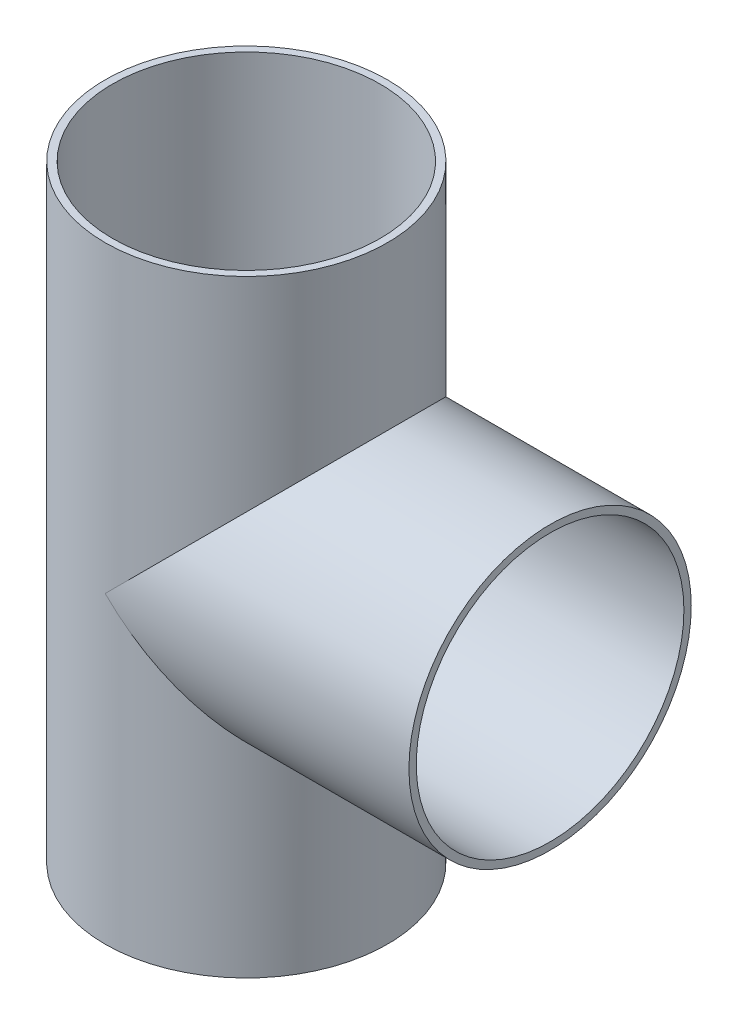
from build123d import *

# Parameters (mm, degrees)
EXTRUDE1_DEPTH          = 68.326
EXTRUDE1_DEPTH_BACK     = 68.326
SKETCH1_R               = 31.75
EXTRUDE2_REACH          = 127.267
EXTRUDE2_END_RADIUS     = 31.75
SKETCH3_R               = 31.75
SKETCH4_R               = 30.099
CUT_EXTRUDE1_DEPTH      = 68.326
CUT_EXTRUDE2_DEPTH      = 102.710112831
CUT_EXTRUDE2_DEPTH_BACK = 102.710112831
SKETCH5_R               = 30.099


with BuildPart() as part:
    # Sketch1 → Extrude1 (new, two sides: drawn at the far end of the back side and taken through both)
    with BuildSketch(Plane(origin=(0, 0, 0), x_dir=(1, 0, 0), z_dir=(0, 1, 0)).offset(-EXTRUDE1_DEPTH_BACK)):
        with Locations(Location((0, 0, 0), (0, 0, 270))):
            Circle(SKETCH1_R)
    extrude(amount=EXTRUDE1_DEPTH + EXTRUDE1_DEPTH_BACK)

    # Extrude2: up to this cylinder (the profile starts outside it)
    extrude2_end = Plane(origin=(0, 0, 0), z_dir=(0, 1, 0)) * Cylinder(EXTRUDE2_END_RADIUS, 319.034, mode=Mode.PRIVATE)
    # Sketch3 → Extrude2 (add, up to the surface)
    with BuildSketch(Plane(origin=(68.326, 0, 0), x_dir=(0, 0, -1), z_dir=(1, 0, 0)), mode=Mode.PRIVATE) as extrude2_sk1:
        Circle(SKETCH3_R)
    extrude2_tool1 = extrude(extrude2_sk1.sketch, amount=-EXTRUDE2_REACH, mode=Mode.PRIVATE) - extrude2_end
    add(extrude2_tool1.solids().sort_by_distance((68.326, 0, 0))[0])

    # Sketch4 → Cut-Extrude1 (cut)
    with BuildSketch(Plane(origin=(68.326, 0, 0), x_dir=(0, 0, -1), z_dir=(1, 0, 0))):
        Circle(SKETCH4_R)
    extrude(amount=-CUT_EXTRUDE1_DEPTH, mode=Mode.SUBTRACT)

    # Sketch5 → Cut-Extrude2 (cut, two sides: drawn at the far end of the back side and taken through both)
    with BuildSketch(Plane(origin=(0, 0, 0), x_dir=(1, 0, 0), z_dir=(0, 1, 0)).offset(-CUT_EXTRUDE2_DEPTH_BACK)):
        with Locations(Location((0, 0, 0), (0, 0, 270))):
            Circle(SKETCH5_R)
    extrude(amount=CUT_EXTRUDE2_DEPTH + CUT_EXTRUDE2_DEPTH_BACK, mode=Mode.SUBTRACT)


solid = part.part
